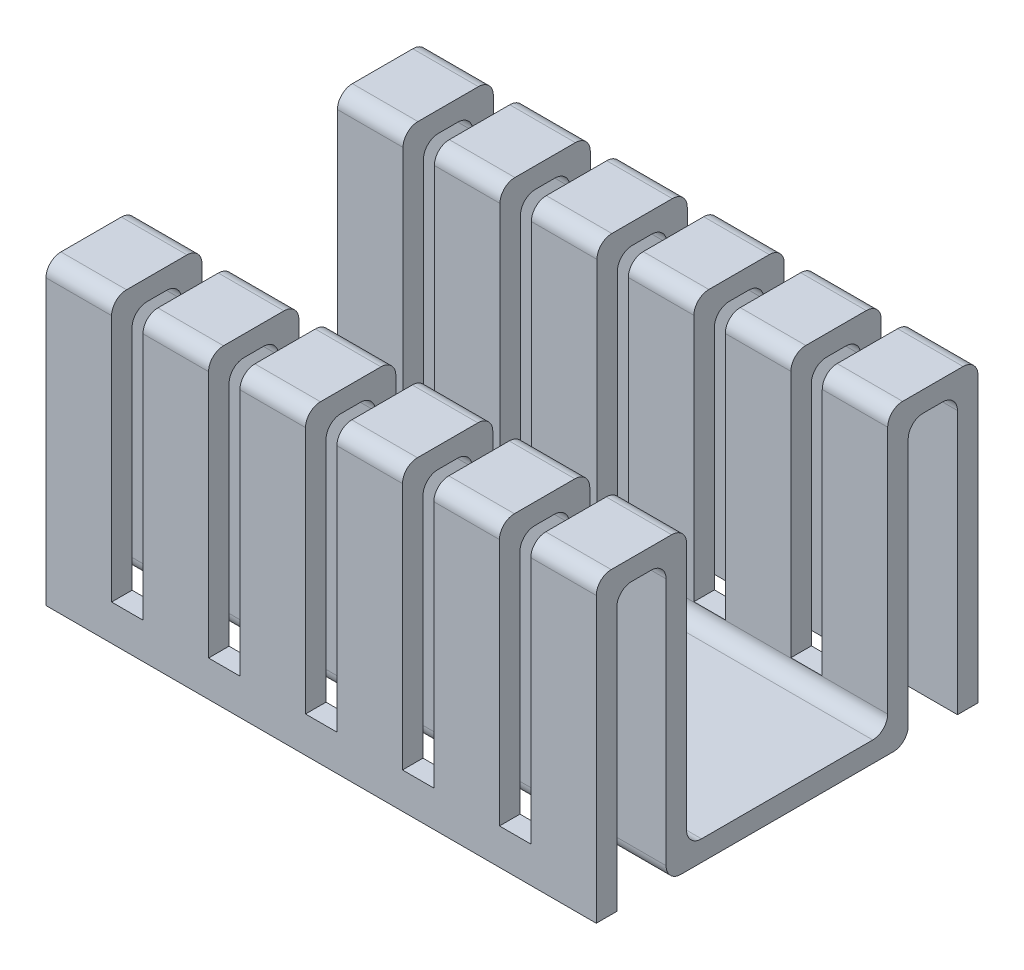
from build123d import *

# Parameters (mm, degrees)
SALIENTE_EXTRUIR1_DEPTH = 36.83
CROQUIS2_R              = 1.84
CROQUIS2_W              = 9.91
CROQUIS2_H              = 9.91
CORTAR_EXTRUIR1_DEPTH   = 49.541066699
CROQUIS3_W              = 2.1
CROQUIS3_H              = 17.6
CORTAR_EXTRUIR2_DEPTH   = 50.084125743


with BuildPart() as part:
    # Croquis1 → Saliente-Extruir1 (new body)
    with BuildSketch(Plane(origin=(0, 0, 0), x_dir=(0, 0, -1), z_dir=(1, 0, 0))):
        with BuildLine():
            Line((0, 0), (0, 19))
            ThreePointArc((0, 19), (-0.292893219, 19.707106781), (-1, 20))
            Line((-1, 20), (-5.045, 20))
            ThreePointArc((-5.045, 20), (-5.752106781, 19.707106781), (-6.045, 19))
            Line((-6.045, 19), (-6.045, 2.3725))
            ThreePointArc((-6.045, 2.3725), (-6.337893219, 1.665393219), (-7.045, 1.3725))
            Line((-7.045, 1.3725), (-18.505, 1.3725))
            ThreePointArc((-18.505, 1.3725), (-19.212106781, 1.665393219), (-19.505, 2.3725))
            Line((-19.505, 2.3725), (-19.505, 19))
            ThreePointArc((-19.505, 19), (-19.797893219, 19.707106781), (-20.505, 20))
            Line((-20.505, 20), (-24.55, 20))
            ThreePointArc((-24.55, 20), (-25.257106781, 19.707106781), (-25.55, 19))
            Line((-25.55, 19), (-25.55, 0))
            Line((-25.55, 0), (-24.1775, 0))
            Line((-24.1775, 0), (-24.1775, 17.6275))
            ThreePointArc((-24.1775, 17.6275), (-23.884606781, 18.334606781), (-23.1775, 18.6275))
            Line((-23.1775, 18.6275), (-21.8775, 18.6275))
            ThreePointArc((-21.8775, 18.6275), (-21.170393219, 18.334606781), (-20.8775, 17.6275))
            Line((-20.8775, 17.6275), (-20.8775, 1))
            ThreePointArc((-20.8775, 1), (-20.584606781, 0.292893219), (-19.8775, 0))
            Line((-19.8775, 0), (-5.6725, 0))
            ThreePointArc((-5.6725, 0), (-4.965393219, 0.292893219), (-4.6725, 1))
            Line((-4.6725, 1), (-4.6725, 17.6275))
            ThreePointArc((-4.6725, 17.6275), (-4.379606781, 18.334606781), (-3.6725, 18.6275))
            Line((-3.6725, 18.6275), (-2.3725, 18.6275))
            ThreePointArc((-2.3725, 18.6275), (-1.665393219, 18.334606781), (-1.3725, 17.6275))
            Line((-1.3725, 17.6275), (-1.3725, 0))
            Line((-1.3725, 0), (0, 0))
        make_face()
    extrude(amount=SALIENTE_EXTRUIR1_DEPTH)

    # Croquis2 → Cortar-Extruir1 (cut, through all)
    with BuildSketch(Plane(origin=(0, 1.3725, 0), x_dir=(1, 0, 0), z_dir=(0, 1, 0))):
        with Locations(Location((23.12, -12.775, 0), (0, 0, 270))):
            Circle(CROQUIS2_R)
        with Locations((4.955, -12.775)):
            Rectangle(CROQUIS2_W, CROQUIS2_H)
    extrude(amount=-CORTAR_EXTRUIR1_DEPTH, mode=Mode.SUBTRACT)

    # Croquis3 → Cortar-Extruir2 (cut, through all)
    with BuildSketch(Plane.XY.offset(25.55)):
        with Locations((5.44, 11.2)):
            Rectangle(CROQUIS3_W, CROQUIS3_H)
        with Locations((11.93, 11.2)):
            Rectangle(CROQUIS3_W, CROQUIS3_H)
        with Locations((18.42, 11.2)):
            Rectangle(CROQUIS3_W, CROQUIS3_H)
        with Locations((24.91, 11.2)):
            Rectangle(CROQUIS3_W, CROQUIS3_H)
        with Locations((31.4, 11.2)):
            Rectangle(CROQUIS3_W, CROQUIS3_H)
    extrude(amount=-CORTAR_EXTRUIR2_DEPTH, mode=Mode.SUBTRACT)


solid = part.part
